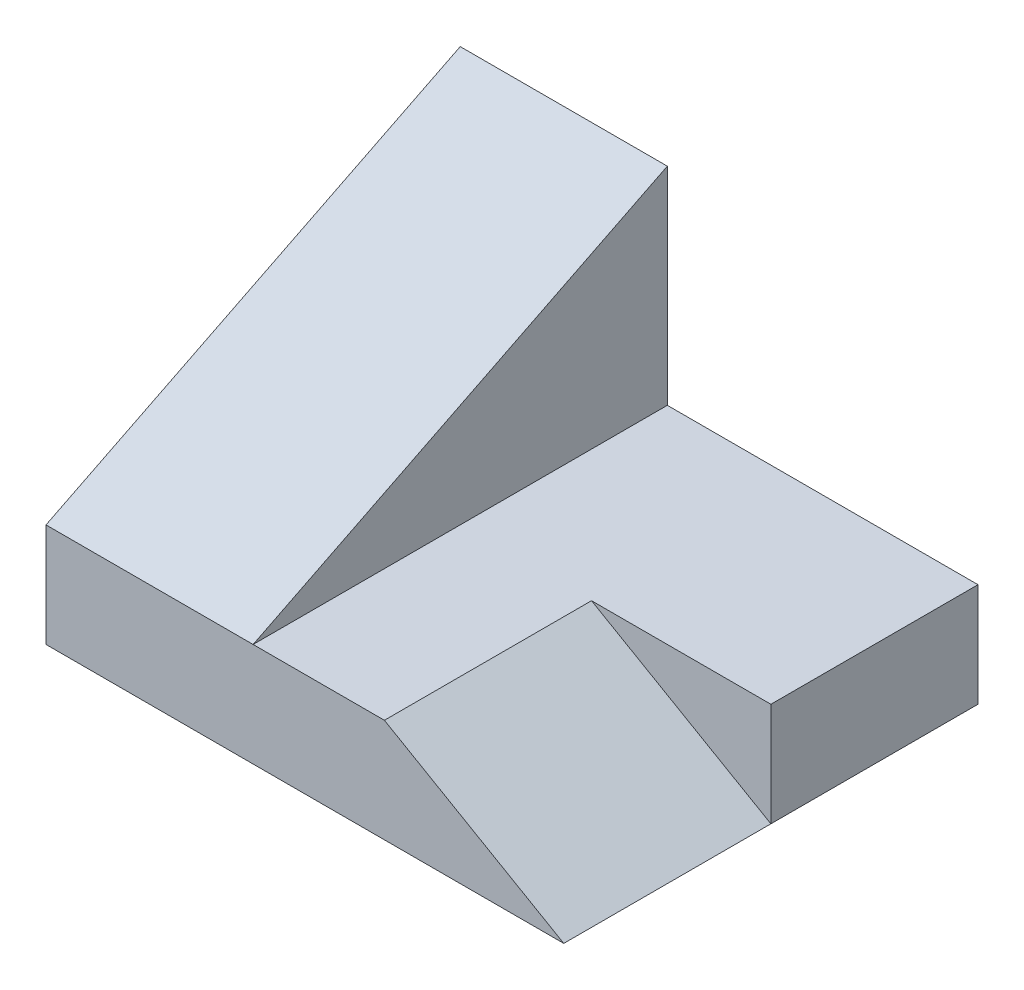
from build123d import *

# Parameters (mm, degrees)
SKETCH1_W           = 50
SKETCH1_H           = 40
BOSS_EXTRUDE1_DEPTH = 10
CUT_EXTRUDE1_DEPTH  = 20
SKETCH3_W           = 20
SKETCH3_H           = 40
BOSS_EXTRUDE2_DEPTH = 20
CUT_EXTRUDE2_DEPTH  = 20


with BuildPart() as part:
    # Sketch1 → Boss-Extrude1 (new body)
    with BuildSketch(Plane(origin=(0, 0, 0), x_dir=(1, 0, 0), z_dir=(0, 1, 0))):
        Rectangle(SKETCH1_W, SKETCH1_H)
    extrude(amount=BOSS_EXTRUDE1_DEPTH)

    # Sketch2 → Cut-Extrude1 (cut)
    with BuildSketch(Plane.XY.offset(20)):
        Polygon((25, 0), (7.679491924, 10), (25, 10), align=None)
    extrude(amount=-CUT_EXTRUDE1_DEPTH, mode=Mode.SUBTRACT)

    # Sketch3 → Boss-Extrude2 (add)
    with BuildSketch(Plane(origin=(0, 10, 0), x_dir=(1, 0, 0), z_dir=(0, 1, 0))):
        with Locations((-15, 0)):
            Rectangle(SKETCH3_W, SKETCH3_H)
    extrude(amount=BOSS_EXTRUDE2_DEPTH)

    # Sketch4 → Cut-Extrude2 (cut)
    with BuildSketch(Plane(origin=(-5, 0, 0), x_dir=(0, 0, -1), z_dir=(1, 0, 0))):
        Polygon((20, 30), (-20, 10), (-20, 30), align=None)
    extrude(amount=-CUT_EXTRUDE2_DEPTH, mode=Mode.SUBTRACT)


solid = part.part
